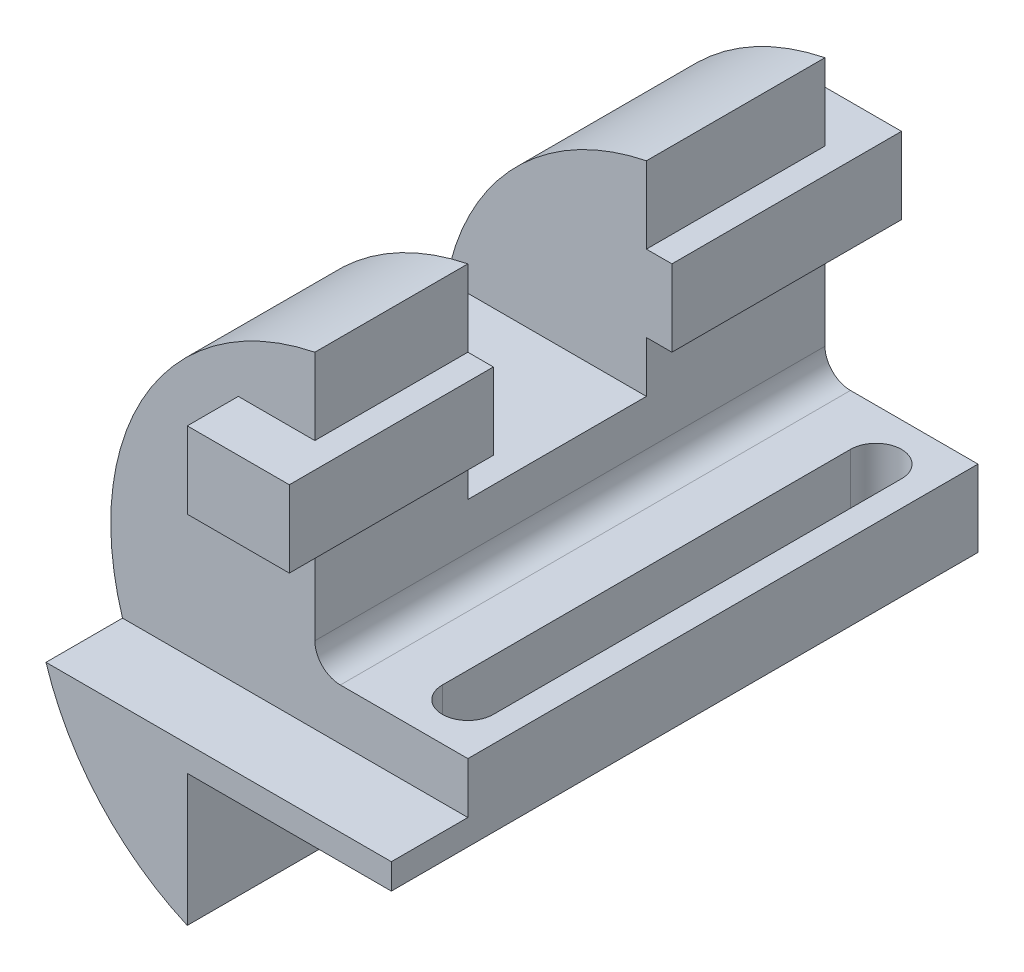
from build123d import *

# Parameters (mm, degrees)
BOSS_EXTRUDE1_DEPTH      = 115
CUT_EXTRUDE4_DEPTH       = 115
CUT_EXTRUDE5_DEPTH       = 115
CUT_EXTRUDE7_DEPTH       = 15
SKETCH8_W                = 35
SKETCH8_H                = 40
CUT_EXTRUDE8_DEPTH       = 55
BOSS_EXTRUDE2_DEPTH      = 10
BOSS_EXTRUDE2_DEPTH_BACK = 30
SKETCH9_W                = 20
SKETCH9_H                = 15
BOSS_EXTRUDE4_DEPTH      = 10
BOSS_EXTRUDE4_DEPTH_BACK = 35
SKETCH10_W               = 15
SKETCH10_H               = 15
SKETCH10_W_2             = 5
CUT_EXTRUDE9_DEPTH       = 35


with BuildPart() as part:
    # Sketch1 → Boss-Extrude1 (new body)
    with BuildSketch(Plane.XY):
        with BuildLine():
            Line((0, 50), (0, -5))
            Line((0, -5), (20, -5))
            Line((20, -5), (20, -20))
            Line((20, -20), (0, -20))
            Line((0, -20), (0, -50))
            ThreePointArc((0, -50), (-50, 0), (0, 50))
        make_face()
    extrude(amount=-BOSS_EXTRUDE1_DEPTH)

    # Sketch2 → Cut-Extrude4 (cut)
    with BuildSketch(Plane.XY):
        with BuildLine():
            Line((0, -5), (-5, -5))
            ThreePointArc((-5, -5), (-8.535533906, -3.535533906), (-10, 0))
            Line((-10, 0), (-10, 48.989794856))
            ThreePointArc((-10, 48.989794856), (-5.0254481, 49.74680765), (0, 50))
            Line((0, 50), (0, -5))
        make_face()
    extrude(amount=-CUT_EXTRUDE4_DEPTH, mode=Mode.SUBTRACT)

    # Sketch6 → Cut-Extrude5 (cut)
    with BuildSketch(Plane.XY):
        with BuildLine():
            Line((0, -20), (-20, -20))
            Line((-20, -20), (-20, -45.82575695))
            ThreePointArc((-20, -45.82575695), (-10.215482184, -48.945315647), (0, -50))
            Line((0, -50), (0, -20))
        make_face()
    extrude(amount=-CUT_EXTRUDE5_DEPTH, mode=Mode.SUBTRACT)

    # Sketch7 → Cut-Extrude7 (cut)
    with BuildSketch(Plane.XY):
        with BuildLine():
            Line((20, -5), (-5, -5))
            ThreePointArc((-5, -5), (-8.535533906, -3.535533906), (-10, 0))
            Line((-10, 0), (-10, 48.989794856))
            ThreePointArc((-10, 48.989794856), (-43.080253734, 25.378962513), (-47.696960071, -15))
            Line((-47.696960071, -15), (20, -15))
            Line((20, -15), (20, -5))
        make_face()
    extrude(amount=-CUT_EXTRUDE7_DEPTH, mode=Mode.SUBTRACT)

    # Sketch8 → Cut-Extrude8 (cut)
    with BuildSketch(Plane(origin=(-10, 0, 0), x_dir=(0, 0, -1), z_dir=(1, 0, 0))):
        with Locations((62.5, 28.989794856)):
            Rectangle(SKETCH8_W, SKETCH8_H)
    extrude(amount=-CUT_EXTRUDE8_DEPTH, mode=Mode.SUBTRACT)

    # Sketch9 → Boss-Extrude2 (add, two sides: drawn at the far end of the back side and taken through both)
    with BuildSketch(Plane.XY.offset(-15).offset(-BOSS_EXTRUDE2_DEPTH_BACK)):
        with Locations((-15, 26.489794856)):
            Rectangle(SKETCH9_W, SKETCH9_H)
    extrude(amount=BOSS_EXTRUDE2_DEPTH + BOSS_EXTRUDE2_DEPTH_BACK)

    # Sketch10 → Boss-Extrude4 (add, two sides: drawn at the far end of the back side and taken through both)
    with BuildSketch(Plane(origin=(0, 0, -115), x_dir=(-1, 0, 0), z_dir=(0, 0, -1)).offset(-BOSS_EXTRUDE4_DEPTH_BACK)):
        with Locations((17.5, 26.489794856)):
            Rectangle(SKETCH10_W, SKETCH10_H)
        with Locations((7.5, 26.489794856)):
            Rectangle(SKETCH10_W_2, SKETCH10_H)
    extrude(amount=BOSS_EXTRUDE4_DEPTH + BOSS_EXTRUDE4_DEPTH_BACK)

    # Sketch11 → Cut-Extrude9 (cut)
    with BuildSketch(Plane(origin=(0, -5, 0), x_dir=(1, 0, 0), z_dir=(0, 1, 0))):
        with BuildLine():
            Line((5, 105), (5, 25))
            ThreePointArc((5, 25), (10, 20), (15, 25))
            Line((15, 25), (15, 105))
            ThreePointArc((15, 105), (10, 110), (5, 105))
        make_face()
    extrude(amount=-CUT_EXTRUDE9_DEPTH, mode=Mode.SUBTRACT)


solid = part.part
